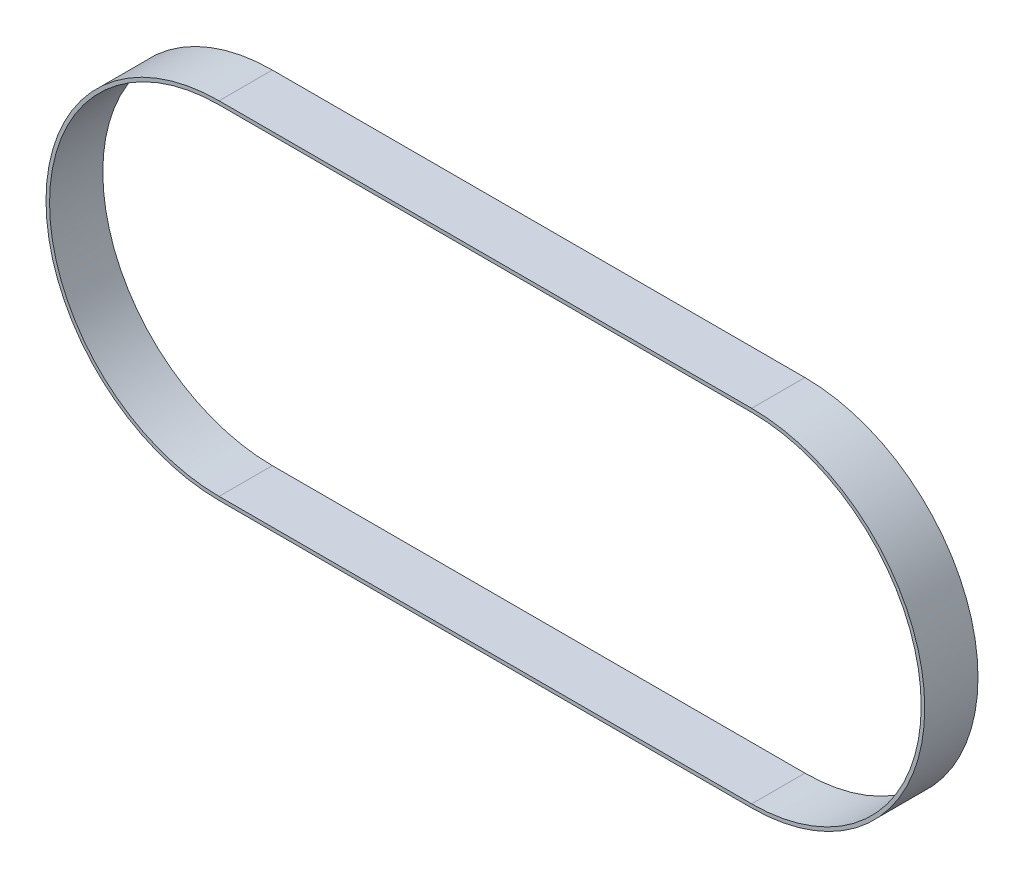
from build123d import *

# Parameters (mm, degrees)
BOSS_EXTRUDE1_DEPTH = 15


with BuildPart() as part:
    # Sketch1 → Boss-Extrude1 (new body)
    with BuildSketch(Plane.XY):
        with BuildLine():
            Line((-75, 48.746482928), (75, 48.746482928))
            ThreePointArc((75, 48.746482928), (123.746482928, 0), (75, -48.746482928))
            Line((75, -48.746482928), (-75, -48.746482928))
            ThreePointArc((-75, -48.746482928), (-123.746482928, 0), (-75, 48.746482928))
        make_face()
        with BuildLine():
            Line((-75, 47.746482928), (75, 47.746482928))
            ThreePointArc((75, 47.746482928), (122.746482928, 0), (75, -47.746482928))
            Line((75, -47.746482928), (-75, -47.746482928))
            ThreePointArc((-75, -47.746482928), (-122.746482928, 0), (-75, 47.746482928))
        make_face(mode=Mode.SUBTRACT)
    extrude(amount=BOSS_EXTRUDE1_DEPTH)


solid = part.part
